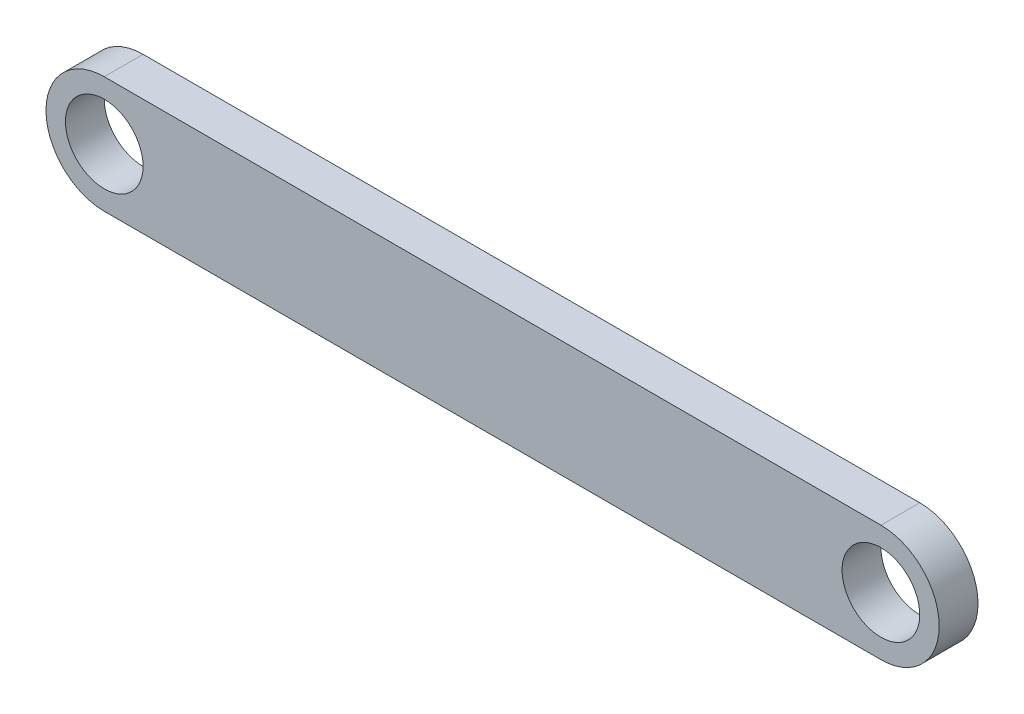
from build123d import *

# Parameters (mm, degrees)
ESQUISSE1_R        = 10
BOSS_EXTRU_1_DEPTH = 5


with BuildPart() as part:
    # Esquisse1 → Boss.-Extru.1 (new, symmetric)
    with BuildSketch(Plane.XY):
        with BuildLine():
            Line((0, -15), (-200, -15))
            ThreePointArc((-200, -15), (-215, 0), (-200, 15))
            Line((-200, 15), (0, 15))
            ThreePointArc((0, 15), (15, 0), (0, -15))
        make_face()
        with Locations((-200, 0)):
            Circle(ESQUISSE1_R, mode=Mode.SUBTRACT)
        Circle(ESQUISSE1_R, mode=Mode.SUBTRACT)
    extrude(amount=BOSS_EXTRU_1_DEPTH, both=True)


solid = part.part
